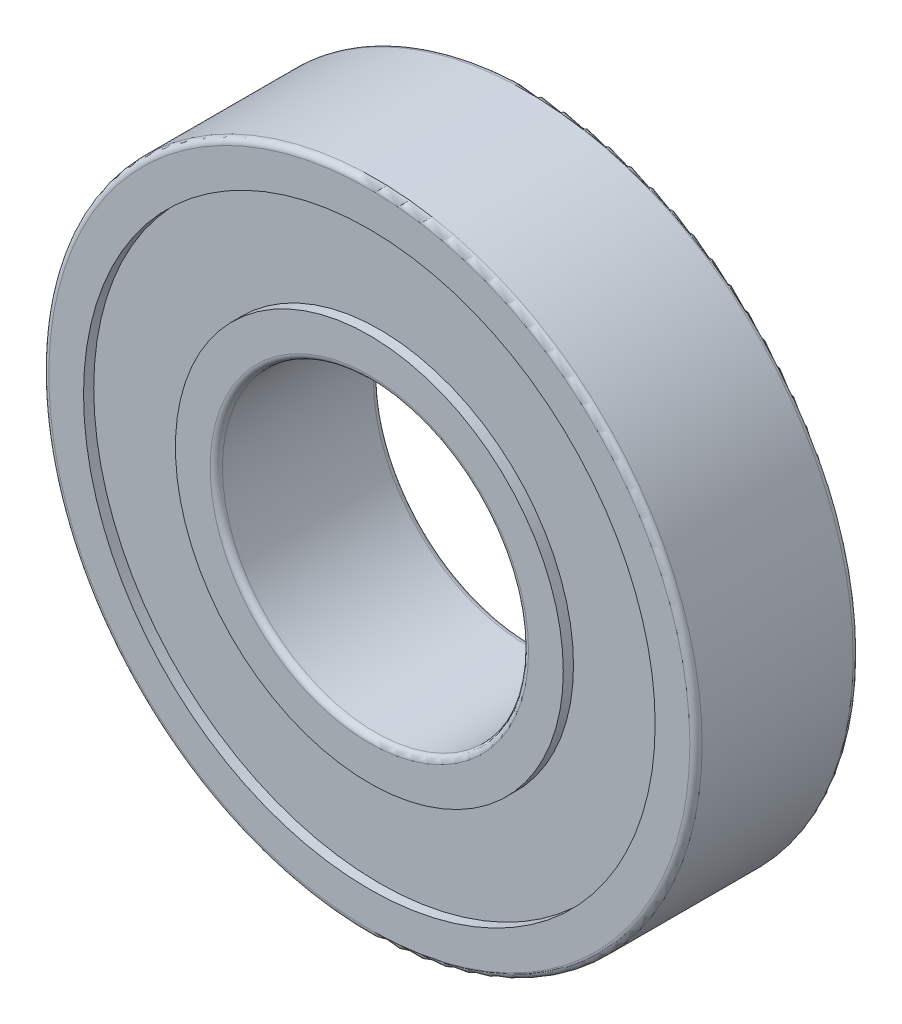
from build123d import *

# Parameters (mm, degrees)
SKETCH1_R           = 16
SKETCH1_R_2         = 7.5
BOSS_EXTRUDE1_DEPTH = 4
SKETCH2_R           = 14
SKETCH2_R_2         = 9.5
CUT_EXTRUDE1_DEPTH  = 0.5
FILLET1_R           = 0.3


with BuildPart() as part:
    # Sketch1 → Boss-Extrude1 (new, symmetric)
    with BuildSketch(Plane.XY):
        Circle(SKETCH1_R)
        Circle(SKETCH1_R_2, mode=Mode.SUBTRACT)
    extrude(amount=BOSS_EXTRUDE1_DEPTH, both=True)

    # Sketch2 → Cut-Extrude1 (cut)
    with BuildSketch(Plane.XY.offset(4)):
        Circle(SKETCH2_R)
        Circle(SKETCH2_R_2, mode=Mode.SUBTRACT)
    cut_extrude1 = extrude(amount=-CUT_EXTRUDE1_DEPTH, mode=Mode.SUBTRACT)

    # Fillet1
    fillet1_edges = [part.edges().sort_by_distance(p)[0] for p in [
        (-16, 0, -4),
        (-16, 0, 4),
        (-7.5, 0, -4),
        (-7.5, 0, 4),
    ]]
    fillet(fillet1_edges, radius=FILLET1_R)

    # Mirror4: Cut-Extrude1 across plane
    add(cut_extrude1.mirror(Plane.XY), mode=Mode.SUBTRACT)


solid = part.part
